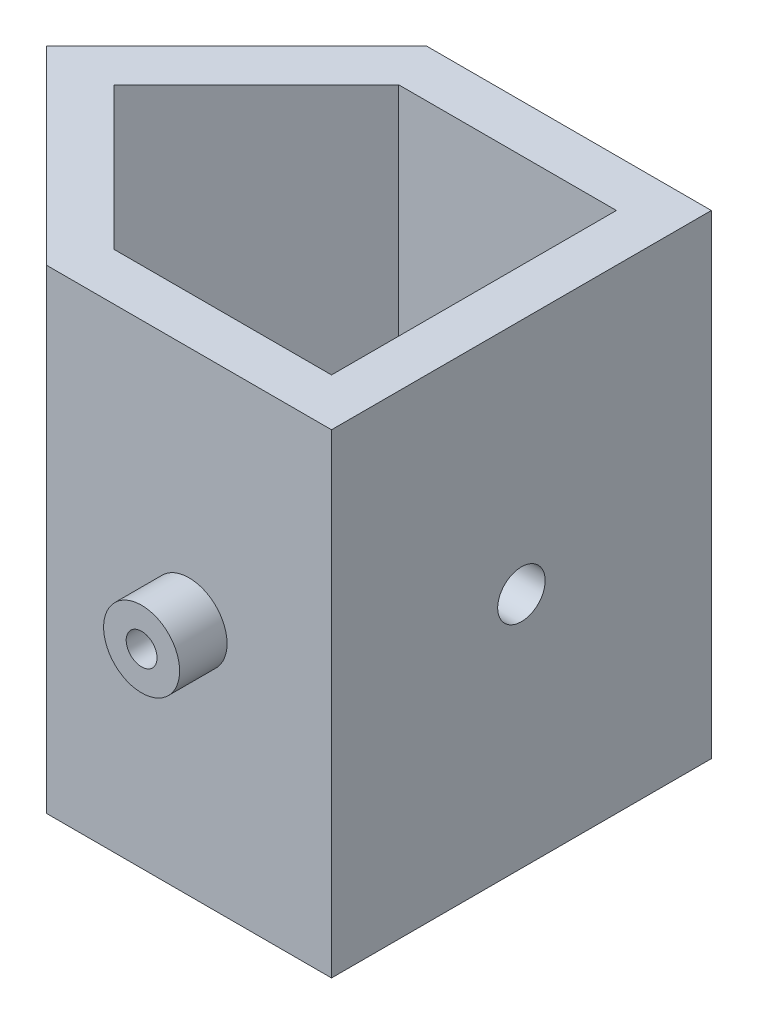
from build123d import *

# Parameters (mm, degrees)
SALIENTE_EXTRUIR1_DEPTH = 50
CROQUIS7_R              = 2.5
CORTAR_EXTRUIR1_DEPTH   = 5
CROQUIS8_R              = 4
SALIENTE_EXTRUIR2_DEPTH = 5
SALIENTE_EXTRUIR3_START = 5
CROQUIS15_R             = 4
SALIENTE_EXTRUIR3_DEPTH = 5
CROQUIS17_R             = 1.625
CORTAR_EXTRUIR4_DEPTH   = 6
CORTAR_EXTRUIR5_START   = -6
CROQUIS16_R             = 1.625
CORTAR_EXTRUIR5_DEPTH   = 6


with BuildPart() as part:
    # Croquis3 → Saliente-Extruir1 (new body)
    with BuildSketch(Plane(origin=(0, 0, 0), x_dir=(1, 0, 0), z_dir=(0, 1, 0))):
        Polygon((0, 0), (20.000000004, 20), (50.000000004, 20), (50.000000004, -20), (20.000000004, -20), align=None)
        Polygon((7.071067811, 2e-09), (22.071067819, 15), (45.000000004, 15), (45.000000004, -15), (22.071067815, -15), align=None, mode=Mode.SUBTRACT)
    extrude(amount=SALIENTE_EXTRUIR1_DEPTH)

    # Croquis7 → Cortar-Extruir1 (cut)
    with BuildSketch(Plane(origin=(50.000000004, 0, 0), x_dir=(0, 0, -1), z_dir=(1, 0, 0))):
        with Locations((0, 25)):
            Circle(CROQUIS7_R)
    extrude(amount=-CORTAR_EXTRUIR1_DEPTH, mode=Mode.SUBTRACT)

    # Croquis8 → Saliente-Extruir2 (add)
    with BuildSketch(Plane.XY.offset(20)):
        with Locations((35.000000004, 25)):
            Circle(CROQUIS8_R)
    extrude(amount=SALIENTE_EXTRUIR2_DEPTH)

    # Croquis15 → Saliente-Extruir3 (add)
    with BuildSketch(Plane(origin=(0, 0, -20), x_dir=(-1, 0, 0), z_dir=(0, 0, -1)).offset(SALIENTE_EXTRUIR3_START)):
        with Locations(Location((-35.000000004, 25, 0), (0, 0, 180))):
            Circle(CROQUIS15_R)
    extrude(amount=-SALIENTE_EXTRUIR3_DEPTH)

    # Croquis17 → Cortar-Extruir4 (cut)
    with BuildSketch(Plane.XY.offset(25)):
        with Locations((35.000000004, 25)):
            Circle(CROQUIS17_R)
    extrude(amount=-CORTAR_EXTRUIR4_DEPTH, mode=Mode.SUBTRACT)

    # Croquis16 → Cortar-Extruir5 (cut)
    with BuildSketch(Plane(origin=(0, 0, -25), x_dir=(-1, 0, 0), z_dir=(0, 0, -1)).offset(CORTAR_EXTRUIR5_START)):
        with Locations(Location((-35.000000004, 25, 0), (0, 0, 180))):
            Circle(CROQUIS16_R)
    extrude(amount=CORTAR_EXTRUIR5_DEPTH, mode=Mode.SUBTRACT)


solid = part.part
